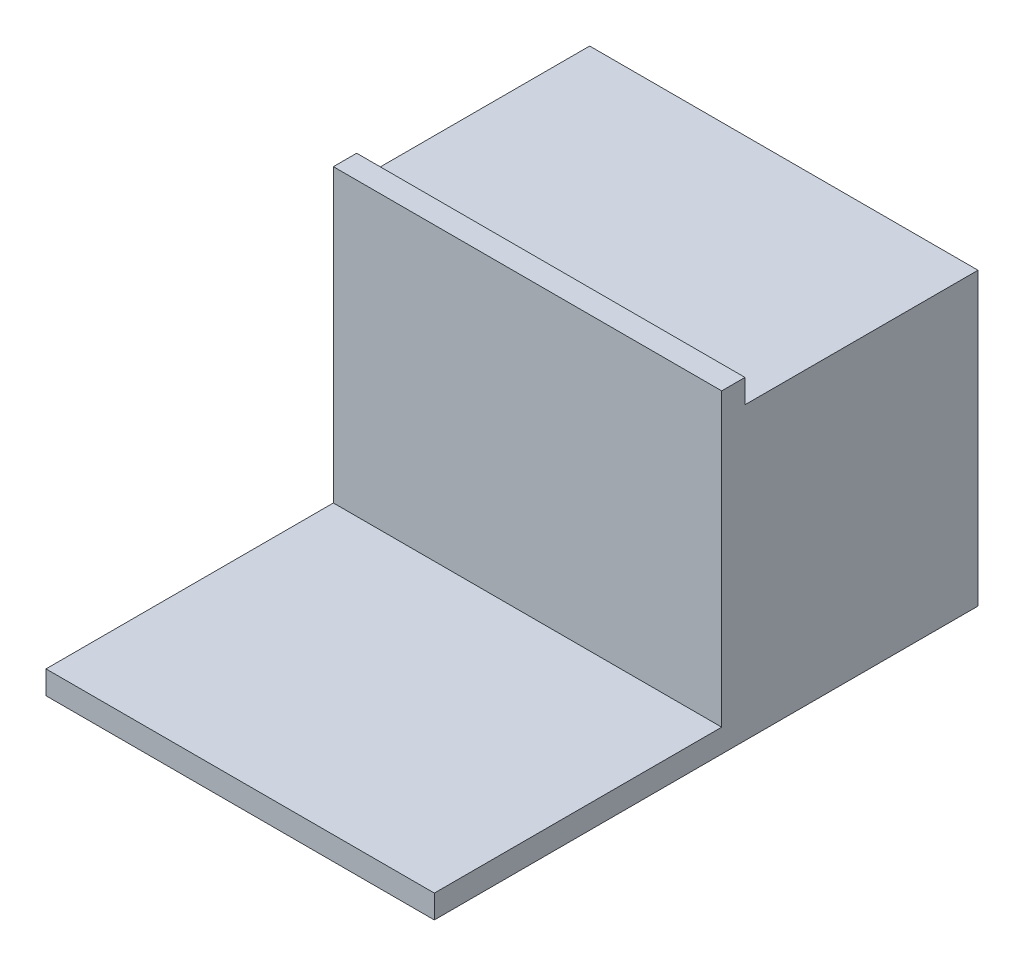
from build123d import *

# Parameters (mm, degrees)
CROQUIS1_W              = 5000
CROQUIS1_H              = 3750
SALIENTE_EXTRUIR1_DEPTH = 300
CROQUIS2_W              = 5000
CROQUIS2_H              = 4000
SALIENTE_EXTRUIR2_DEPTH = 300
CROQUIS3_W              = 5000
CROQUIS3_H              = 3745.2
SALIENTE_EXTRUIR3_DEPTH = 3000


with BuildPart() as part:
    # Croquis1 → Saliente-Extruir1 (new body)
    with BuildSketch(Plane(origin=(0, 0, 0), x_dir=(-1, 0, 0), z_dir=(0, 0, -1))):
        with Locations((2500, 1875)):
            Rectangle(CROQUIS1_W, CROQUIS1_H)
    extrude(amount=-SALIENTE_EXTRUIR1_DEPTH)

    # Croquis2 → Saliente-Extruir2 (add)
    with BuildSketch(Plane.XZ):
        with Locations((-2500, 2000)):
            Rectangle(CROQUIS2_W, CROQUIS2_H)
    extrude(amount=SALIENTE_EXTRUIR2_DEPTH)

    # Croquis3 → Saliente-Extruir3 (add)
    with BuildSketch(Plane(origin=(0, 0, 0), x_dir=(-1, 0, 0), z_dir=(0, 0, -1))):
        with Locations((2500, 1572.6)):
            Rectangle(CROQUIS3_W, CROQUIS3_H)
    extrude(amount=SALIENTE_EXTRUIR3_DEPTH)


solid = part.part
